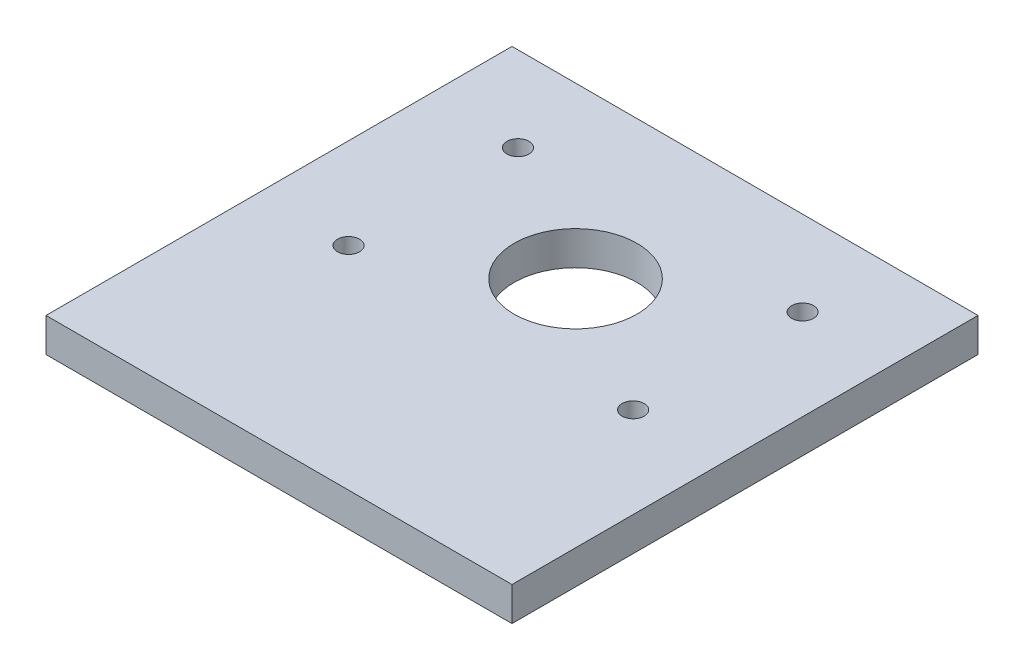
from build123d import *

# Parameters (mm, degrees)
SKETCH1_W           = 110
SKETCH1_H           = 110
SKETCH1_R           = 14.5
SKETCH1_R_2         = 2.6
BOSS_EXTRUDE1_DEPTH = 8


with BuildPart() as part:
    # Sketch1 → Boss-Extrude1 (new body)
    with BuildSketch(Plane(origin=(0, 0, 0), x_dir=(1, 0, 0), z_dir=(0, 1, 0))):
        Rectangle(SKETCH1_W, SKETCH1_H)
        with Locations(Location((0, 15, 0), (0, 0, 270))):
            Circle(SKETCH1_R, mode=Mode.SUBTRACT)
        with Locations(Location((-33.5915, 35, 0), (0, 0, 270))):
            Circle(SKETCH1_R_2, mode=Mode.SUBTRACT)
        with Locations(Location((33.5915, 35, 0), (0, 0, 270))):
            Circle(SKETCH1_R_2, mode=Mode.SUBTRACT)
        with Locations(Location((33.5915, -5, 0), (0, 0, 270))):
            Circle(SKETCH1_R_2, mode=Mode.SUBTRACT)
        with Locations(Location((-33.5915, -5, 0), (0, 0, 270))):
            Circle(SKETCH1_R_2, mode=Mode.SUBTRACT)
    extrude(amount=BOSS_EXTRUDE1_DEPTH)


solid = part.part
